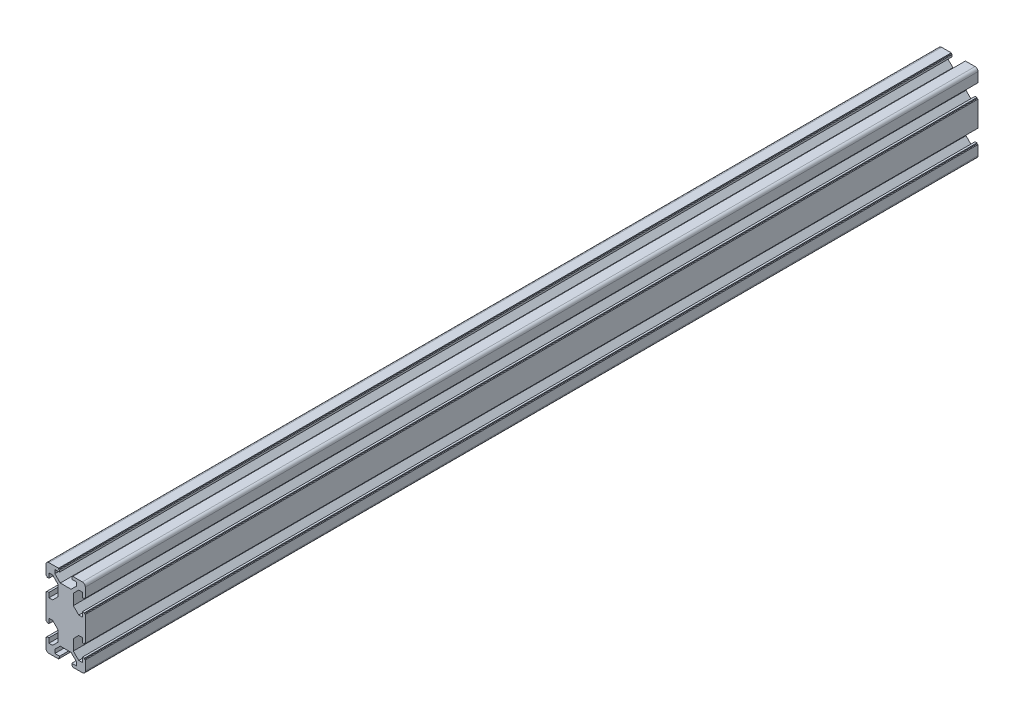
from build123d import *

# Parameters (mm, degrees)
EXTRUDE_1_DEPTH = 454


with BuildPart() as part:
    # Sketch1 → 凸台-拉伸1 (new body)
    with BuildSketch(Plane.XY):
        with BuildLine():
            Line((-3.6, 10), (-3.6, 9.5))
            Line((-3.6, 9.5), (-3.1, 9.5))
            Line((-3.1, 9.5), (-3.1, 8.5))
            Line((-3.1, 8.5), (-5.5, 8.5))
            Line((-5.5, 8.5), (-5.5, 6.65))
            Line((-5.5, 6.65), (-2.75, 3.9))
            Line((-2.75, 3.9), (2.75, 3.9))
            Line((2.75, 3.9), (5.5, 6.65))
            Line((5.5, 6.65), (5.5, 8.5))
            Line((5.5, 8.5), (3.1, 8.5))
            Line((3.1, 8.5), (3.1, 9.5))
            Line((3.1, 9.5), (3.6, 9.5))
            Line((3.6, 9.5), (3.6, 10))
            Line((3.6, 10), (8.5, 10))
            ThreePointArc((8.5, 10), (9.560660172, 9.560660172), (10, 8.5))
            Line((10, 8.5), (10, 3.6))
            Line((10, 3.6), (9.5, 3.6))
            Line((9.5, 3.6), (9.5, 3.1))
            Line((9.5, 3.1), (8.5, 3.1))
            Line((8.5, 3.1), (8.5, 5.5))
            Line((8.5, 5.5), (6.65, 5.5))
            Line((6.65, 5.5), (3.9, 2.75))
            Line((3.9, 2.75), (3.9, -2.75))
            Line((3.9, -2.75), (6.65, -5.5))
            Line((6.65, -5.5), (8.5, -5.5))
            Line((8.5, -5.5), (8.5, -3.1))
            Line((8.5, -3.1), (9.5, -3.1))
            Line((9.5, -3.1), (9.5, -3.6))
            Line((9.5, -3.6), (10, -3.6))
            Line((10, -3.6), (10, -16.4))
            Line((10, -16.4), (9.5, -16.4))
            Line((9.5, -16.4), (9.5, -16.9))
            Line((9.5, -16.9), (8.5, -16.9))
            Line((8.5, -16.9), (8.5, -14.5))
            Line((8.5, -14.5), (6.65, -14.5))
            Line((6.65, -14.5), (3.9, -17.25))
            Line((3.9, -17.25), (3.9, -22.75))
            Line((3.9, -22.75), (6.65, -25.5))
            Line((6.65, -25.5), (8.5, -25.5))
            Line((8.5, -25.5), (8.5, -23.1))
            Line((8.5, -23.1), (9.5, -23.1))
            Line((9.5, -23.1), (9.5, -23.6))
            Line((9.5, -23.6), (10, -23.6))
            Line((10, -23.6), (10, -28.5))
            ThreePointArc((10, -28.5), (9.560660172, -29.560660172), (8.5, -30))
            Line((8.5, -30), (3.6, -30))
            Line((3.6, -30), (3.6, -29.5))
            Line((3.6, -29.5), (3.1, -29.5))
            Line((3.1, -29.5), (3.1, -28.5))
            Line((3.1, -28.5), (5.5, -28.5))
            Line((5.5, -28.5), (5.5, -26.65))
            Line((5.5, -26.65), (2.75, -23.9))
            Line((2.75, -23.9), (-2.75, -23.9))
            Line((-2.75, -23.9), (-5.5, -26.65))
            Line((-5.5, -26.65), (-5.5, -28.5))
            Line((-5.5, -28.5), (-3.1, -28.5))
            Line((-3.1, -28.5), (-3.1, -29.5))
            Line((-3.1, -29.5), (-3.6, -29.5))
            Line((-3.6, -29.5), (-3.6, -30))
            Line((-3.6, -30), (-8.5, -30))
            ThreePointArc((-8.5, -30), (-9.560660172, -29.560660172), (-10, -28.5))
            Line((-10, -28.5), (-10, -23.6))
            Line((-10, -23.6), (-9.5, -23.6))
            Line((-9.5, -23.6), (-9.5, -23.1))
            Line((-9.5, -23.1), (-8.5, -23.1))
            Line((-8.5, -23.1), (-8.5, -25.5))
            Line((-8.5, -25.5), (-6.65, -25.5))
            Line((-6.65, -25.5), (-3.9, -22.75))
            Line((-3.9, -22.75), (-3.9, -17.25))
            Line((-3.9, -17.25), (-6.65, -14.5))
            Line((-6.65, -14.5), (-8.5, -14.5))
            Line((-8.5, -14.5), (-8.5, -16.9))
            Line((-8.5, -16.9), (-9.5, -16.9))
            Line((-9.5, -16.9), (-9.5, -16.4))
            Line((-9.5, -16.4), (-10, -16.4))
            Line((-10, -16.4), (-10, -3.6))
            Line((-10, -3.6), (-9.5, -3.6))
            Line((-9.5, -3.6), (-9.5, -3.1))
            Line((-9.5, -3.1), (-8.5, -3.1))
            Line((-8.5, -3.1), (-8.5, -5.5))
            Line((-8.5, -5.5), (-6.65, -5.5))
            Line((-6.65, -5.5), (-3.9, -2.75))
            Line((-3.9, -2.75), (-3.9, 2.75))
            Line((-3.9, 2.75), (-6.65, 5.5))
            Line((-6.65, 5.5), (-8.5, 5.5))
            Line((-8.5, 5.5), (-8.5, 3.1))
            Line((-8.5, 3.1), (-9.5, 3.1))
            Line((-9.5, 3.1), (-9.5, 3.6))
            Line((-9.5, 3.6), (-10, 3.6))
            Line((-10, 3.6), (-10, 8.5))
            ThreePointArc((-10, 8.5), (-9.560660172, 9.560660172), (-8.5, 10))
            Line((-8.5, 10), (-3.6, 10))
        make_face()
    extrude(amount=EXTRUDE_1_DEPTH)


solid = part.part
